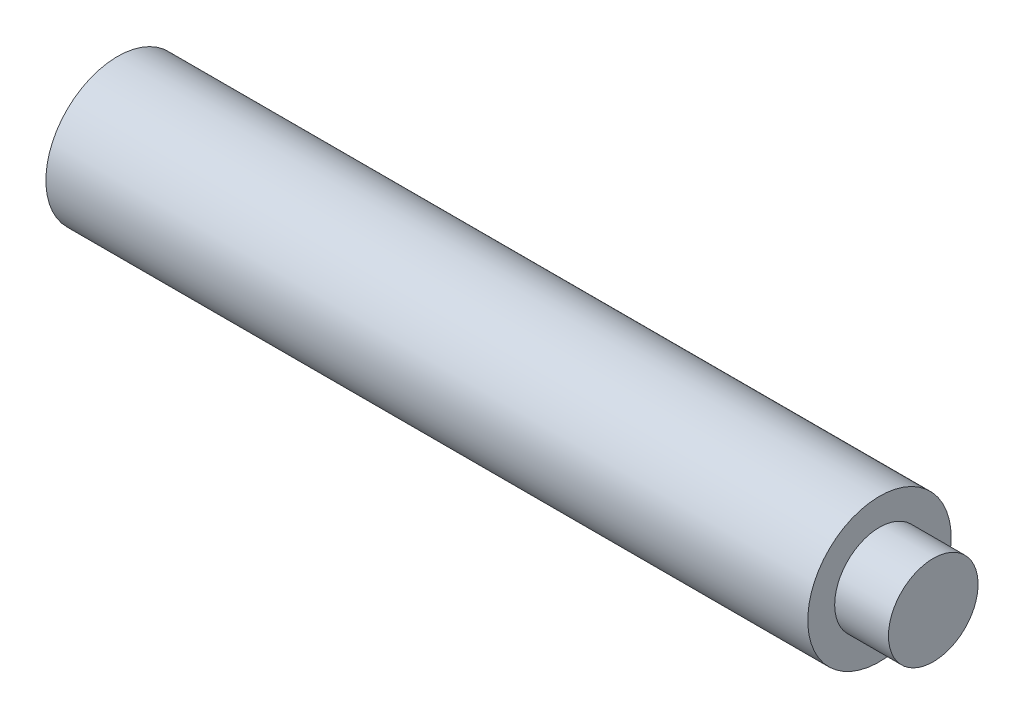
from build123d import *

# Parameters (mm, degrees)
SKETCH1_R           = 101.6
BOSS_EXTRUDE1_DEPTH = 539.75
SKETCH2_R           = 63.5
BOSS_EXTRUDE2_DEPTH = 76.2


with BuildPart() as part:
    # Sketch1 → Boss-Extrude1 (new, symmetric)
    with BuildSketch(Plane(origin=(0, 0, 0), x_dir=(0, 0, -1), z_dir=(1, 0, 0))):
        Circle(SKETCH1_R)
    extrude(amount=BOSS_EXTRUDE1_DEPTH, both=True)

    # Sketch2 → Boss-Extrude2 (add)
    with BuildSketch(Plane(origin=(539.75, 0, 0), x_dir=(0, 0, -1), z_dir=(1, 0, 0))):
        with Locations(Location((0, 0, 0), (0, 0, 180))):
            Circle(SKETCH2_R)
    extrude(amount=BOSS_EXTRUDE2_DEPTH)


solid = part.part
